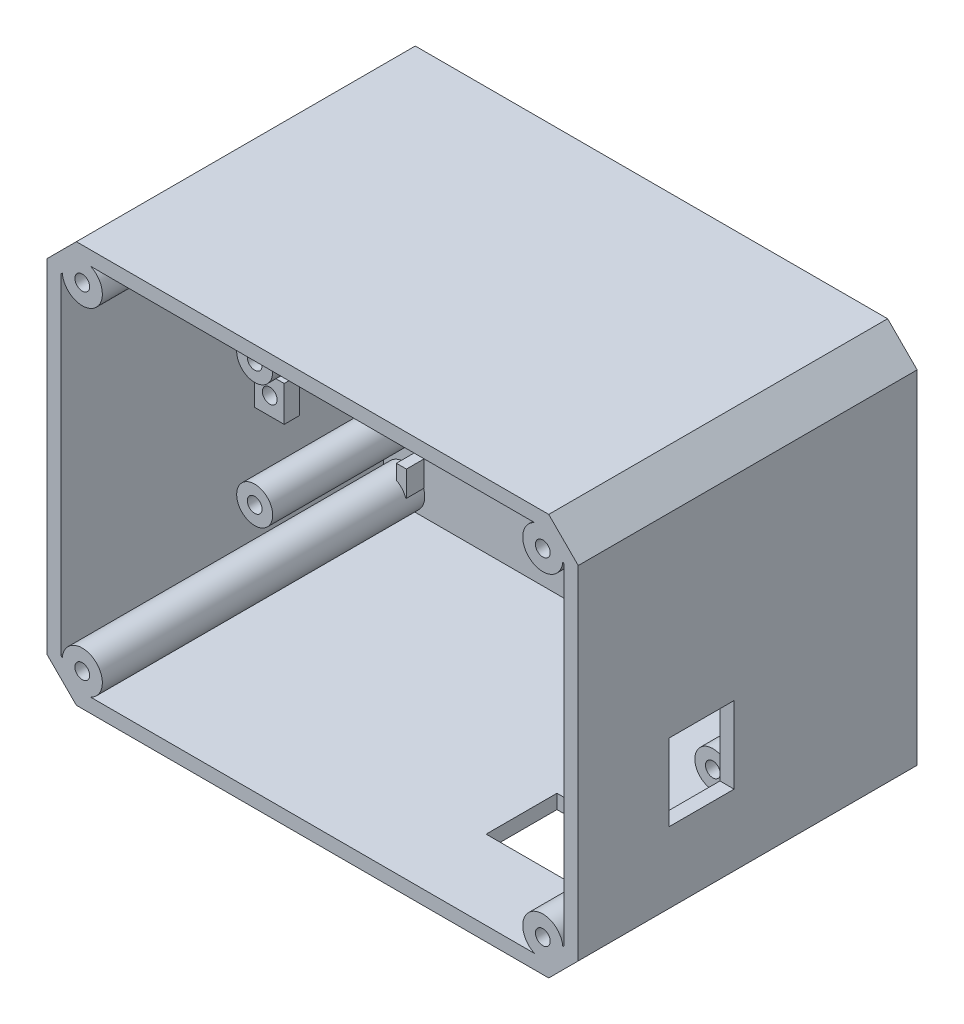
from build123d import *

# Parameters (mm, degrees)
FLOOR_CASE_MOUNTING_AND_BATTERY_ST_2_R       = 2.1
FLOOR_CASE_MOUNTING_AND_BATTERY_STRAP_DEPTH  = 2.8
F_2_4_START                                  = 2.8
F_2_4_MM_WALLS_DEPTH                         = 54.6
LID_START                                    = 2.8
LID_POSTS_D2_5_PILOTS_CORE_PROFILE_R         = 3.4
LID_POSTS_D2_5_PILOTS_CORE_DEPTH             = 46.6
LID_START_2                                  = 49.4
LID_POSTS_D2_5_PILOTS_PROFILE_R              = 3.4
LID_POSTS_D2_5_PILOTS_PROFILE_R_2            = 1.25
LID_POSTS_D2_5_PILOTS_DEPTH                  = 8
UPPER_START                                  = 2.8
UPPER_SHELF_POSTS_D2_5_PILOTS_CORE_PRO_R     = 3.05
UPPER_SHELF_POSTS_D2_5_PILOTS_CORE_DEPTH     = 19.6
UPPER_START_2                                = 22.4
UPPER_SHELF_POSTS_D2_5_PILOTS_PROFILE_R      = 3.05
UPPER_SHELF_POSTS_D2_5_PILOTS_PROFILE_R_2    = 1.25
UPPER_SHELF_POSTS_D2_5_PILOTS_DEPTH          = 6
IIM_START                                    = 2.8
IIM_SENSOR_TWO_D1_65_PILOTS_ON_19_2_R        = 3
IIM_SENSOR_TWO_D1_65_PILOTS_ON_19_2_R_2      = 0.825
IIM_SENSOR_TWO_D1_65_PILOTS_ON_19_MM_C_DEPTH = 3.6
LC76G_START                                  = 2.8
LC76G_PROVISIONAL_D1_65_PILOTS_PROFILE_R     = 2.65
LC76G_PROVISIONAL_D1_65_PILOTS_PROFILE_R_2   = 0.825
LC76G_PROVISIONAL_D1_65_PILOTS_DEPTH         = 3.6
GNSS_START                                   = 2.8
GNSS_UN_DRILLED_SUPPORT_PROFILE_W            = 3.9
GNSS_UN_DRILLED_SUPPORT_PROFILE_H            = 4.8
GNSS_UN_DRILLED_SUPPORT_DEPTH                = 3.6
BATTERY_START                                = 2.8
BATTERY_LOCATING_END_STOPS_PROFILE_W         = 1.7
BATTERY_LOCATING_END_STOPS_PROFILE_H         = 4.3
BATTERY_LOCATING_END_STOPS_PROFILE_W_2       = 2.5
BATTERY_LOCATING_END_STOPS_PROFILE_H_2       = 2.8
BATTERY_LOCATING_END_STOPS_DEPTH             = 3
POWER_START                                  = 9.4
POWER_PLATE_GUIDE_SEATS_PROFILE_W            = 6.1
POWER_PLATE_GUIDE_SEATS_PROFILE_H            = 5.3
POWER_PLATE_GUIDE_SEATS_DEPTH                = 2.4
POWER_START_2                                = 11.8
POWER_PLATE_REAR_GUIDE_CHANNELS_DEPTH        = 18.3
POWER_START_3                                = 30.1
POWER_PLATE_GUIDE_ENDS_KEEPER_WASH_2_R       = 1.05
POWER_PLATE_GUIDE_ENDS_KEEPER_WASHER_P_DEPTH = 4.5
VERTICAL_START                               = 11
VERTICAL_CABLE_TIES_D2_5_GUIDE_EYES_PR_W     = 5.2
VERTICAL_CABLE_TIES_D2_5_GUIDE_EYES_PR_H     = 6
VERTICAL_CABLE_TIES_D2_5_GUIDE_EYES_PR_R     = 1.25
VERTICAL_CABLE_TIES_D2_5_GUIDE_EYES_DEPTH    = 2.6
UPPER_START_3                                = 22
UPPER_CABLE_TIE_EYE_PROFILE_W                = 5.2
UPPER_CABLE_TIE_EYE_PROFILE_H                = 6
UPPER_CABLE_TIE_EYE_PROFILE_R                = 1.25
UPPER_CABLE_TIE_EYE_DEPTH                    = 2.6
USB_START                                    = 42
USB_ACCESS_RESERVE_13_X_11_PROFILE_W         = 3.4
USB_ACCESS_RESERVE_13_X_11_PROFILE_H         = 13
USB_ACCESS_RESERVE_13_X_11_DEPTH             = 11
LORA_START                                   = 44
LORA_ANTENNA_RESERVE_16_X_12_PROFILE_W       = 16
LORA_ANTENNA_RESERVE_16_X_12_PROFILE_H       = 3.4
LORA_ANTENNA_RESERVE_16_X_12_DEPTH           = 12


with BuildPart() as part:
    # Floor - case mounting and battery st 2 → Floor - case mounting and battery strap (new body)
    with BuildSketch(Plane.XY):
        Polygon((-40, -34), (40, -34), (45, -29), (45, 29), (40, 34), (-40, 34), (-45, 29), (-45, -29), align=None)
        with Locations((-39, -8)):
            Circle(FLOOR_CASE_MOUNTING_AND_BATTERY_ST_2_R, mode=Mode.SUBTRACT)
        with Locations((39, -8)):
            Circle(FLOOR_CASE_MOUNTING_AND_BATTERY_ST_2_R, mode=Mode.SUBTRACT)
        with Locations((-39, 20)):
            Circle(FLOOR_CASE_MOUNTING_AND_BATTERY_ST_2_R, mode=Mode.SUBTRACT)
        with Locations((39, 20)):
            Circle(FLOOR_CASE_MOUNTING_AND_BATTERY_ST_2_R, mode=Mode.SUBTRACT)
        with BuildLine():
            Line((-0.1, -31.15), (5.1, -31.15))
            ThreePointArc((5.1, -31.15), (6, -30.25), (5.1, -29.35))
            Line((5.1, -29.35), (-0.1, -29.35))
            ThreePointArc((-0.1, -29.35), (-1, -30.25), (-0.1, -31.15))
        make_face(mode=Mode.SUBTRACT)
        with BuildLine():
            Line((0, 5.2), (5, 5.2))
            ThreePointArc((5, 5.2), (6, 6.2), (5, 7.2))
            Line((5, 7.2), (0, 7.2))
            ThreePointArc((0, 7.2), (-1, 6.2), (0, 5.2))
        make_face(mode=Mode.SUBTRACT)
    extrude(amount=FLOOR_CASE_MOUNTING_AND_BATTERY_STRAP_DEPTH)

    # 2.4 mm walls profile → 2.4 mm walls (add)
    with BuildSketch(Plane.XY.offset(F_2_4_START)):
        Polygon((-40, -34), (40, -34), (45, -29), (45, 29), (40, 34), (-40, 34), (-45, 29), (-45, -29), align=None)
        Polygon((-39, -31.6), (39, -31.6), (42.6, -28), (42.6, 28), (39, 31.6), (-39, 31.6), (-42.6, 28), (-42.6, -28), align=None, mode=Mode.SUBTRACT)
    extrude(amount=F_2_4_MM_WALLS_DEPTH)

    # Lid posts - D2.5 pilots core profile → Lid posts - D2.5 pilots core (add)
    with BuildSketch(Plane.XY.offset(LID_START)):
        with Locations((-39, -28.5)):
            Circle(LID_POSTS_D2_5_PILOTS_CORE_PROFILE_R)
        with Locations((39, -28.5)):
            Circle(LID_POSTS_D2_5_PILOTS_CORE_PROFILE_R)
        with Locations((-39, 28.5)):
            Circle(LID_POSTS_D2_5_PILOTS_CORE_PROFILE_R)
        with Locations((39, 28.5)):
            Circle(LID_POSTS_D2_5_PILOTS_CORE_PROFILE_R)
    extrude(amount=LID_POSTS_D2_5_PILOTS_CORE_DEPTH)

    # Lid posts - D2.5 pilots profile → Lid posts - D2.5 pilots (add)
    # profile 1 of 4: a face of its own
    with BuildSketch(Plane.XY.offset(LID_START_2)):
        with Locations((-39, -28.5)):
            Circle(LID_POSTS_D2_5_PILOTS_PROFILE_R)
        with Locations((-39, -28.5)):
            Circle(LID_POSTS_D2_5_PILOTS_PROFILE_R_2, mode=Mode.SUBTRACT)
    # profile 2 of 4: a face of its own
    with BuildSketch(Plane.XY.offset(LID_START_2)):
        with Locations((39, -28.5)):
            Circle(LID_POSTS_D2_5_PILOTS_PROFILE_R)
        with Locations((39, -28.5)):
            Circle(LID_POSTS_D2_5_PILOTS_PROFILE_R_2, mode=Mode.SUBTRACT)
    # profile 3 of 4: a face of its own
    with BuildSketch(Plane.XY.offset(LID_START_2)):
        with Locations((-39, 28.5)):
            Circle(LID_POSTS_D2_5_PILOTS_PROFILE_R)
        with Locations((-39, 28.5)):
            Circle(LID_POSTS_D2_5_PILOTS_PROFILE_R_2, mode=Mode.SUBTRACT)
    # profile 4 of 4: a face of its own
    with BuildSketch(Plane.XY.offset(LID_START_2)):
        with Locations((39, 28.5)):
            Circle(LID_POSTS_D2_5_PILOTS_PROFILE_R)
        with Locations((39, 28.5)):
            Circle(LID_POSTS_D2_5_PILOTS_PROFILE_R_2, mode=Mode.SUBTRACT)
    extrude(amount=LID_POSTS_D2_5_PILOTS_DEPTH)

    # Upper shelf posts - D2.5 pilots core profile → Upper shelf posts - D2.5 pilots core (add)
    with BuildSketch(Plane.XY.offset(UPPER_START)):
        with Locations((-38.8, -18.5)):
            Circle(UPPER_SHELF_POSTS_D2_5_PILOTS_CORE_PRO_R)
        with Locations((38.8, -18.5)):
            Circle(UPPER_SHELF_POSTS_D2_5_PILOTS_CORE_PRO_R)
        with Locations((-38.8, 2.5)):
            Circle(UPPER_SHELF_POSTS_D2_5_PILOTS_CORE_PRO_R)
        with Locations((38.8, 2.5)):
            Circle(UPPER_SHELF_POSTS_D2_5_PILOTS_CORE_PRO_R)
    extrude(amount=UPPER_SHELF_POSTS_D2_5_PILOTS_CORE_DEPTH)

    # Upper shelf posts - D2.5 pilots profile → Upper shelf posts - D2.5 pilots (add)
    # profile 1 of 4: a face of its own
    with BuildSketch(Plane.XY.offset(UPPER_START_2)):
        with Locations((-38.8, -18.5)):
            Circle(UPPER_SHELF_POSTS_D2_5_PILOTS_PROFILE_R)
        with Locations((-38.8, -18.5)):
            Circle(UPPER_SHELF_POSTS_D2_5_PILOTS_PROFILE_R_2, mode=Mode.SUBTRACT)
    # profile 2 of 4: a face of its own
    with BuildSketch(Plane.XY.offset(UPPER_START_2)):
        with Locations((38.8, -18.5)):
            Circle(UPPER_SHELF_POSTS_D2_5_PILOTS_PROFILE_R)
        with Locations((38.8, -18.5)):
            Circle(UPPER_SHELF_POSTS_D2_5_PILOTS_PROFILE_R_2, mode=Mode.SUBTRACT)
    # profile 3 of 4: a face of its own
    with BuildSketch(Plane.XY.offset(UPPER_START_2)):
        with Locations((-38.8, 2.5)):
            Circle(UPPER_SHELF_POSTS_D2_5_PILOTS_PROFILE_R)
        with Locations((-38.8, 2.5)):
            Circle(UPPER_SHELF_POSTS_D2_5_PILOTS_PROFILE_R_2, mode=Mode.SUBTRACT)
    # profile 4 of 4: a face of its own
    with BuildSketch(Plane.XY.offset(UPPER_START_2)):
        with Locations((38.8, 2.5)):
            Circle(UPPER_SHELF_POSTS_D2_5_PILOTS_PROFILE_R)
        with Locations((38.8, 2.5)):
            Circle(UPPER_SHELF_POSTS_D2_5_PILOTS_PROFILE_R_2, mode=Mode.SUBTRACT)
    extrude(amount=UPPER_SHELF_POSTS_D2_5_PILOTS_DEPTH)

    # IIM sensor - two D1.65 pilots on 19  2 → IIM sensor - two D1.65 pilots on 19 mm c (add)
    # profile 1 of 2: a face of its own
    with BuildSketch(Plane.XY.offset(IIM_START)):
        with Locations((7, 28)):
            Circle(IIM_SENSOR_TWO_D1_65_PILOTS_ON_19_2_R)
        with Locations((7, 28)):
            Circle(IIM_SENSOR_TWO_D1_65_PILOTS_ON_19_2_R_2, mode=Mode.SUBTRACT)
    # profile 2 of 2: a face of its own
    with BuildSketch(Plane.XY.offset(IIM_START)):
        with Locations((26, 28)):
            Circle(IIM_SENSOR_TWO_D1_65_PILOTS_ON_19_2_R)
        with Locations((26, 28)):
            Circle(IIM_SENSOR_TWO_D1_65_PILOTS_ON_19_2_R_2, mode=Mode.SUBTRACT)
    extrude(amount=IIM_SENSOR_TWO_D1_65_PILOTS_ON_19_MM_C_DEPTH)

    # LC76G provisional D1.65 pilots profile → LC76G provisional D1.65 pilots (add)
    # profile 1 of 2: a face of its own
    with BuildSketch(Plane.XY.offset(LC76G_START)):
        with Locations((-29.25, 8.3)):
            Circle(LC76G_PROVISIONAL_D1_65_PILOTS_PROFILE_R)
        with Locations((-29.25, 8.3)):
            Circle(LC76G_PROVISIONAL_D1_65_PILOTS_PROFILE_R_2, mode=Mode.SUBTRACT)
    # profile 2 of 2: a face of its own
    with BuildSketch(Plane.XY.offset(LC76G_START)):
        with Locations((-29.25, 28.8)):
            Circle(LC76G_PROVISIONAL_D1_65_PILOTS_PROFILE_R)
        with Locations((-29.25, 28.8)):
            Circle(LC76G_PROVISIONAL_D1_65_PILOTS_PROFILE_R_2, mode=Mode.SUBTRACT)
    extrude(amount=LC76G_PROVISIONAL_D1_65_PILOTS_DEPTH)

    # GNSS un-drilled support profile → GNSS un-drilled support (add)
    with BuildSketch(Plane.XY.offset(GNSS_START)):
        with Locations((-3.65, 25.8)):
            Rectangle(GNSS_UN_DRILLED_SUPPORT_PROFILE_W, GNSS_UN_DRILLED_SUPPORT_PROFILE_H)
    extrude(amount=GNSS_UN_DRILLED_SUPPORT_DEPTH)

    # Battery locating end stops profile → Battery locating end stops (add)
    with BuildSketch(Plane.XY.offset(BATTERY_START)):
        with Locations((-36.55, -25.15)):
            Rectangle(BATTERY_LOCATING_END_STOPS_PROFILE_W, BATTERY_LOCATING_END_STOPS_PROFILE_H)
        with Locations((34.95, -26.6)):
            Rectangle(BATTERY_LOCATING_END_STOPS_PROFILE_W_2, BATTERY_LOCATING_END_STOPS_PROFILE_H_2)
    extrude(amount=BATTERY_LOCATING_END_STOPS_DEPTH)

    # Power plate guide seats profile → Power plate guide seats (add)
    with BuildSketch(Plane.XY.offset(POWER_START)):
        with Locations((-33.15, 29.45)):
            Rectangle(POWER_PLATE_GUIDE_SEATS_PROFILE_W, POWER_PLATE_GUIDE_SEATS_PROFILE_H)
        with Locations((33.15, 29.45)):
            Rectangle(POWER_PLATE_GUIDE_SEATS_PROFILE_W, POWER_PLATE_GUIDE_SEATS_PROFILE_H)
    extrude(amount=POWER_PLATE_GUIDE_SEATS_DEPTH)

    # Power plate rear guide channels profile → Power plate rear guide channels (add)
    with BuildSketch(Plane.XY.offset(POWER_START_2)):
        Polygon((30.1, 26.8), (36.2, 26.8), (36.2, 32.1), (32.4, 32.1), (32.4, 27.75), (30.1, 27.75), align=None)
        Polygon((-30.1, 26.8), (-36.2, 26.8), (-36.2, 32.1), (-32.4, 32.1), (-32.4, 27.75), (-30.1, 27.75), align=None)
    extrude(amount=POWER_PLATE_REAR_GUIDE_CHANNELS_DEPTH)

    # Power plate guide ends - keeper wash 2 → Power plate guide ends - keeper washer p (add)
    # profile 1 of 2: a face of its own
    with BuildSketch(Plane.XY.offset(POWER_START_3)):
        Polygon((30.1, 26.8), (36.2, 26.8), (36.2, 32.1), (32.4, 32.1), (32.4, 27.75), (30.1, 27.75), align=None)
        with Locations((34.1, 29.4)):
            Circle(POWER_PLATE_GUIDE_ENDS_KEEPER_WASH_2_R, mode=Mode.SUBTRACT)
    # profile 2 of 2: a face of its own
    with BuildSketch(Plane.XY.offset(POWER_START_3)):
        Polygon((-30.1, 26.8), (-36.2, 26.8), (-36.2, 32.1), (-32.4, 32.1), (-32.4, 27.75), (-30.1, 27.75), align=None)
        with Locations((-34.1, 29.4)):
            Circle(POWER_PLATE_GUIDE_ENDS_KEEPER_WASH_2_R, mode=Mode.SUBTRACT)
    extrude(amount=POWER_PLATE_GUIDE_ENDS_KEEPER_WASHER_P_DEPTH)

    # Vertical cable ties - D2.5 guide eyes profile → Vertical cable ties - D2.5 guide eyes (add)
    with BuildSketch(Plane.XY.offset(VERTICAL_START)):
        with Locations((-40.2, -5)):
            Rectangle(VERTICAL_CABLE_TIES_D2_5_GUIDE_EYES_PR_W, VERTICAL_CABLE_TIES_D2_5_GUIDE_EYES_PR_H)
        with Locations((-40.05, -5)):
            Circle(VERTICAL_CABLE_TIES_D2_5_GUIDE_EYES_PR_R, mode=Mode.SUBTRACT)
    extrude(amount=VERTICAL_CABLE_TIES_D2_5_GUIDE_EYES_DEPTH)

    # Upper cable tie eye profile → Upper cable tie eye (add)
    with BuildSketch(Plane.XY.offset(UPPER_START_3)):
        with Locations((-40.2, -5)):
            Rectangle(UPPER_CABLE_TIE_EYE_PROFILE_W, UPPER_CABLE_TIE_EYE_PROFILE_H)
        with Locations((-40.05, -5)):
            Circle(UPPER_CABLE_TIE_EYE_PROFILE_R, mode=Mode.SUBTRACT)
    extrude(amount=UPPER_CABLE_TIE_EYE_DEPTH)

    # USB access reserve 13 x 11 profile → USB access reserve 13 x 11 (cut)
    with BuildSketch(Plane.XY.offset(USB_START)):
        with Locations((43.7, -10.5)):
            Rectangle(USB_ACCESS_RESERVE_13_X_11_PROFILE_W, USB_ACCESS_RESERVE_13_X_11_PROFILE_H)
    extrude(amount=-USB_ACCESS_RESERVE_13_X_11_DEPTH, mode=Mode.SUBTRACT)

    # LoRa antenna reserve 16 x 12 profile → LoRa antenna reserve 16 x 12 (cut)
    with BuildSketch(Plane.XY.offset(LORA_START)):
        with Locations((24, -32.7)):
            Rectangle(LORA_ANTENNA_RESERVE_16_X_12_PROFILE_W, LORA_ANTENNA_RESERVE_16_X_12_PROFILE_H)
    extrude(amount=-LORA_ANTENNA_RESERVE_16_X_12_DEPTH, mode=Mode.SUBTRACT)


solid = part.part
